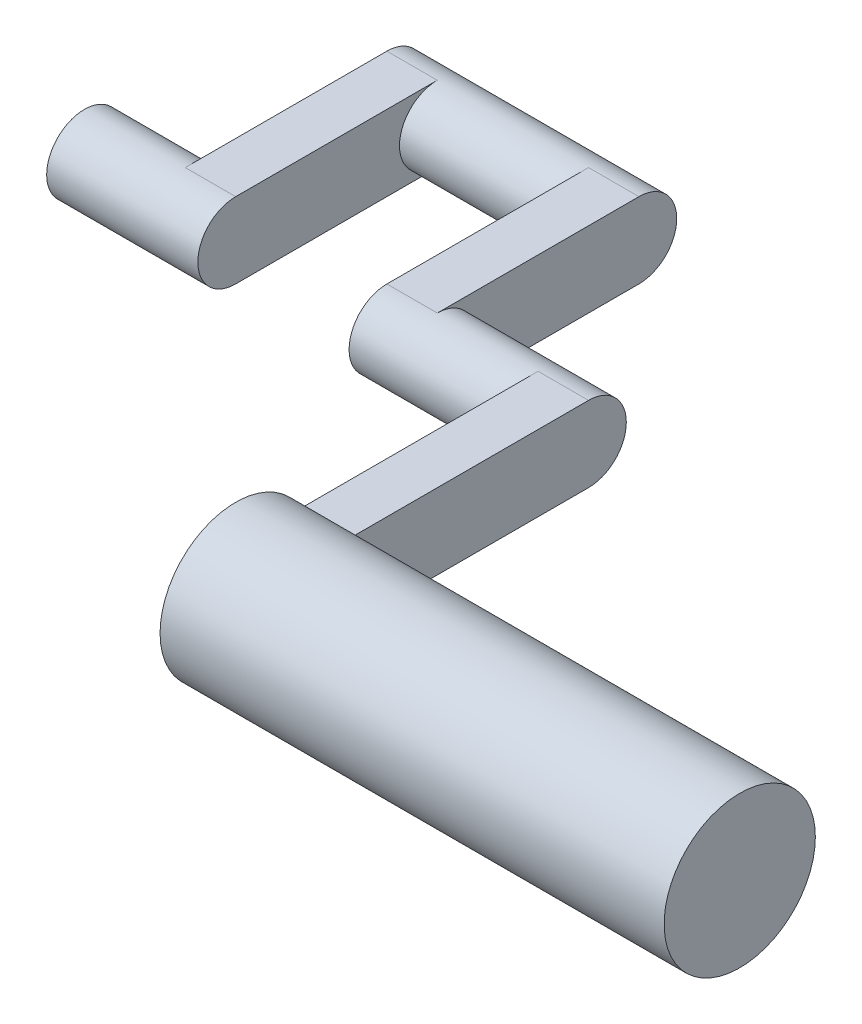
from build123d import *

# Parameters (mm, degrees)
SKETCH1_R           = 19.05
BOSS_EXTRUDE1_DEPTH = 127
BOSS_EXTRUDE2_START = -12.7
SKETCH2_R           = 9.525000000000007
BOSS_EXTRUDE2_DEPTH = 12.7
SKETCH2_3_R         = 9.525000000000007
BOSS_EXTRUDE3_DEPTH = 38.1
BOSS_EXTRUDE4_START = -12.7
SKETCH3_R           = 9.525000000000007
BOSS_EXTRUDE4_DEPTH = 12.7
SKETCH3_3_R         = 9.525000000000007
BOSS_EXTRUDE5_DEPTH = 50.8
BOSS_EXTRUDE6_START = 38.099999999999994
SKETCH3_4_R         = 9.525000000000007
BOSS_EXTRUDE6_DEPTH = 12.7
BOSS_EXTRUDE7_START = 88.9
SKETCH2_4_R         = 9.525000000000007
BOSS_EXTRUDE7_DEPTH = 25.4


with BuildPart() as part:
    # Sketch1 → Boss-Extrude1 (new body)
    with BuildSketch(Plane(origin=(0, 0, 0), x_dir=(0, 0, -1), z_dir=(1, 0, 0))):
        Circle(SKETCH1_R)
    extrude(amount=-BOSS_EXTRUDE1_DEPTH)

    # Sketch2 → Boss-Extrude2 (add)
    with BuildSketch(Plane.ZY.offset(127).offset(BOSS_EXTRUDE2_START)):
        with BuildLine():
            Line((-16.497783942092994, 9.525000000000002), (-76.2, 9.525000000000007))
            ThreePointArc((-76.2, 9.525000000000007), (-69.46480790919813, 6.73519209080187), (-66.675, 0))
            ThreePointArc((-66.675, -2.33e-15), (-69.46480790919813, -6.735192090801872), (-76.2, -9.525000000000007))
            Line((-76.2, -9.525000000000007), (-16.497783942092994, -9.525000000000002))
            ThreePointArc((-16.49778394209321, -9.525000000000603), (-19.05, 2.33e-15), (-16.497783942093204, 9.525000000000615))
        make_face()
        with BuildLine():
            ThreePointArc((19.05, 0), (4.930502809203364, 18.400886990806658), (-16.497783942093204, 9.525000000000615))
            Line((-16.497783942092994, 9.525000000000002), (0, 9.525))
            Line((0, 9.525), (0, -9.525))
            Line((0, -9.525), (-16.497783942092994, -9.525000000000002))
            ThreePointArc((-16.49778394209321, -9.525000000000603), (4.930502809203355, -18.40088699080666), (19.05, -4.67e-15))
        make_face()
        with BuildLine():
            Line((0, 9.525), (-16.497783942092994, 9.525000000000002))
            ThreePointArc((-16.497783942093204, 9.525000000000615), (-19.05, 2.33e-15), (-16.49778394209321, -9.525000000000603))
            Line((-16.497783942092994, -9.525000000000002), (0, -9.525))
            Line((0, -9.525), (0, 9.525))
        make_face()
        with Locations((-76.2, 0)):
            Circle(SKETCH2_R)
    extrude(amount=BOSS_EXTRUDE2_DEPTH)

    # Sketch2<3> → Boss-Extrude3 (add)
    with BuildSketch(Plane.ZY.offset(127)):
        with Locations((-76.2, 0)):
            Circle(SKETCH2_3_R)
    extrude(amount=BOSS_EXTRUDE3_DEPTH)

    # Sketch3 → Boss-Extrude4 (add)
    with BuildSketch(Plane.ZY.offset(165.1).offset(BOSS_EXTRUDE4_START)):
        with BuildLine():
            Line((-76.2, 9.525000000000007), (-127, 9.525000000000007))
            ThreePointArc((-127, 9.525000000000007), (-120.26480790919813, 6.73519209080187), (-117.475, 0))
            ThreePointArc((-117.475, -2.33e-15), (-120.26480790919813, -6.735192090801872), (-127, -9.525000000000007))
            Line((-127, -9.525000000000007), (-76.2, -9.525000000000007))
            ThreePointArc((-76.2, -9.525000000000006), (-85.72500000000001, 1.17e-15), (-76.2, 9.525000000000006))
        make_face()
        with Locations((-127, 0)):
            Circle(SKETCH3_R)
    extrude(amount=BOSS_EXTRUDE4_DEPTH)

    # Sketch3<3> → Boss-Extrude5 (add)
    with BuildSketch(Plane.ZY.offset(165.1)):
        with Locations((-127, 0)):
            Circle(SKETCH3_3_R)
    extrude(amount=BOSS_EXTRUDE5_DEPTH)

    # Sketch3<4> → Boss-Extrude6 (add)
    with BuildSketch(Plane.ZY.offset(165.1).offset(BOSS_EXTRUDE6_START)):
        with BuildLine():
            Line((-76.2, 9.525000000000007), (-127, 9.525000000000007))
            ThreePointArc((-127, 9.525000000000007), (-120.26480790919813, 6.73519209080187), (-117.475, 0))
            ThreePointArc((-117.475, -2.33e-15), (-120.26480790919813, -6.735192090801872), (-127, -9.525000000000007))
            Line((-127, -9.525000000000007), (-76.2, -9.525000000000007))
            ThreePointArc((-76.2, -9.525000000000006), (-85.72500000000001, 1.17e-15), (-76.2, 9.525000000000006))
        make_face()
        with Locations(Location((-76.2, 0, 0), (0, 0, 90))):
            Circle(SKETCH3_4_R)
    extrude(amount=BOSS_EXTRUDE6_DEPTH)

    # Sketch2<4> → Boss-Extrude7 (add)
    with BuildSketch(Plane.ZY.offset(127).offset(BOSS_EXTRUDE7_START)):
        with Locations(Location((-76.2, 0, 0), (0, 0, 90))):
            Circle(SKETCH2_4_R)
    extrude(amount=BOSS_EXTRUDE7_DEPTH)


solid = part.part
